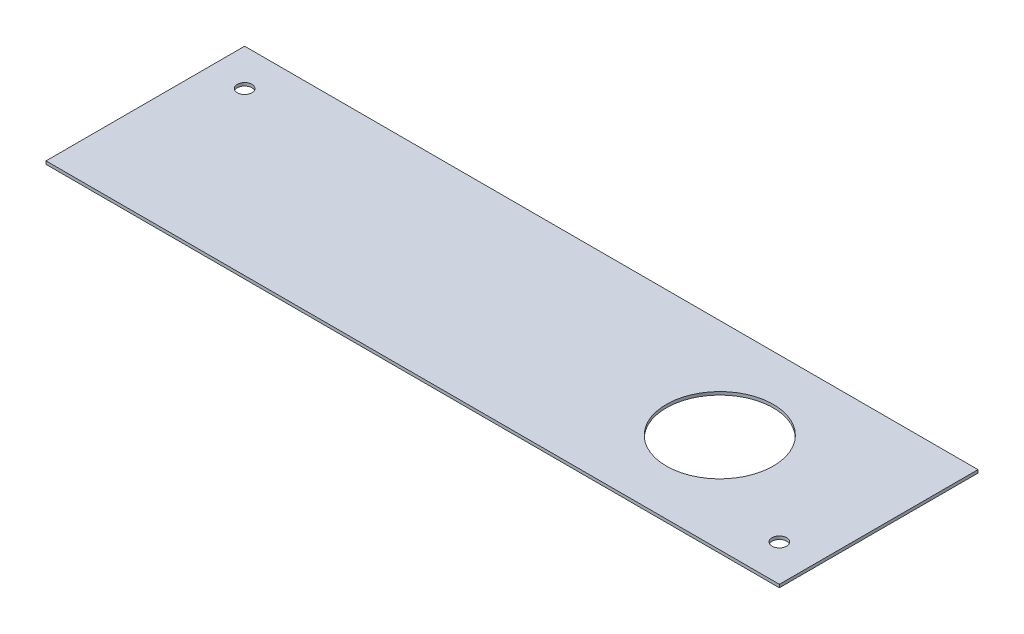
from build123d import *

# Parameters (mm, degrees)
SKETCH1_W            = 240
SKETCH1_H            = 65
BOSS_EXTRUDE1_DEPTH  = 1
M4_CLEARANCE_SLOT1_D = 4.8
SKETCH4_R            = 17.5
CUT_EXTRUDE1_DEPTH   = 5


with BuildPart() as part:
    # Sketch1 → Boss-Extrude1 (new body)
    with BuildSketch(Plane(origin=(0, 0, 0), x_dir=(1, 0, 0), z_dir=(0, 1, 0))):
        with Locations((-52.116935484, -7.731854839)):
            Rectangle(SKETCH1_W, SKETCH1_H)
    extrude(amount=BOSS_EXTRUDE1_DEPTH)

    # M4 Clearance Slot1 (through all)
    with Locations(Plane(origin=(0, 1, 0), x_dir=(1, 0, 0), z_dir=(0, 1, 0))):
        with Locations((-160.116935484, 12.768145161), (55.883064516, -28.231854839)):
            Hole(M4_CLEARANCE_SLOT1_D / 2)

    # Sketch4 → Cut-Extrude1 (cut)
    with BuildSketch(Plane(origin=(0, 1, 0), x_dir=(1, 0, 0), z_dir=(0, 1, 0))):
        with Locations(Location((15.883064516, -7.731854839, 0), (0, 0, 270))):
            Circle(SKETCH4_R)
    extrude(amount=-CUT_EXTRUDE1_DEPTH, mode=Mode.SUBTRACT)


solid = part.part
